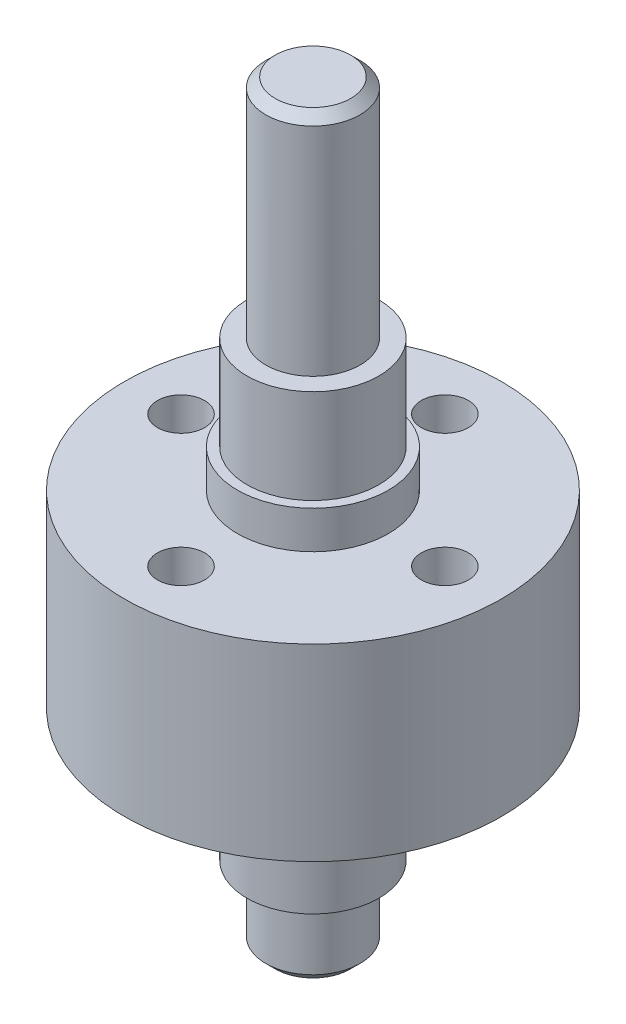
from build123d import *

# Parameters (mm, degrees)
HOLE_WIZARD_M3_1_D = 2.5
CHAMFER_1_SIZE     = 0.5


with BuildPart() as part:
    # 草图1 → 旋转1 (revolve)
    with BuildSketch(Plane.XY, mode=Mode.PRIVATE) as revolve_1_sk:
        Polygon((0, 0), (0, 40), (2.5, 40), (2.5, 28), (3.5, 28), (3.5, 23), (4, 23), (4, 21), (10, 21), (10, 11), (4, 11), (4, 9), (3.5, 9), (3.5, 4), (2.5, 4), (2.5, 0), align=None)
    revolve(revolve_1_sk.sketch.rotate(Axis((0, 0, 0), (0, 1, 0)), 90), axis=Axis((0, 0, 0), (0, 1, 0)))

    # M3 螺纹孔1 (through all)
    with Locations(Plane(origin=(0, 21, 0), x_dir=(1, 0, 0), z_dir=(0, 1, 0))):
        with Locations((0, 7), (7, 0), (0, -7), (-7, 0)):
            Hole(HOLE_WIZARD_M3_1_D / 2)

    # 倒角1
    chamfer_1_edges = [part.edges().sort_by_distance(p)[0] for p in [
        (0, 0, 2.5),
        (0, 40, 2.5),
    ]]
    chamfer(chamfer_1_edges, length=CHAMFER_1_SIZE)


solid = part.part
